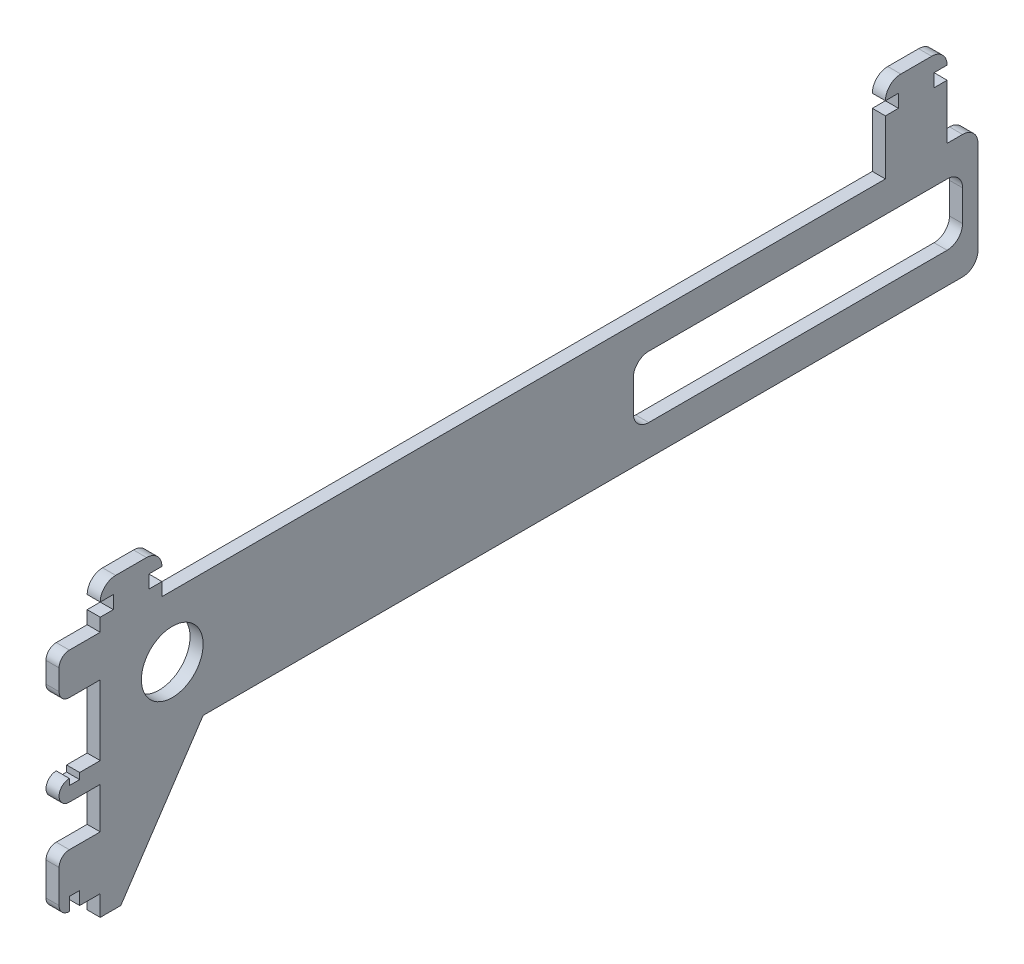
from build123d import *

# Parameters (mm, degrees)
SKETCH1_R           = 7.5
BOSS_EXTRUDE1_DEPTH = 3.175


with BuildPart() as part:
    # Sketch1 → Boss-Extrude1 (new body)
    with BuildSketch(Plane(origin=(0, 0, 0), x_dir=(0, 0, -1), z_dir=(1, 0, 0))):
        with BuildLine():
            Line((-94.755, 15), (-94.755, 18.175))
            Line((-94.755, 18.175), (-97.93, 18.175))
            Line((-97.93, 18.175), (-97.93, 21.35))
            Line((-97.93, 21.35), (-94.755, 21.35))
            ThreePointArc((-94.755, 21.35), (-95.853349571, 24.001650429), (-98.505, 25.1))
            Line((-98.505, 25.1), (-106.005, 25.1))
            ThreePointArc((-106.005, 25.1), (-108.656650429, 24.001650429), (-109.755, 21.35))
            Line((-109.755, 21.35), (-106.58, 21.35))
            Line((-106.58, 21.35), (-106.58, 18.175))
            Line((-106.58, 18.175), (-109.755, 18.175))
            Line((-109.755, 18.175), (-109.755, 15))
            Line((-109.755, 15), (-117.255, 15))
            ThreePointArc((-117.255, 15), (-119.022766953, 14.267766953), (-119.755, 12.5))
            Line((-119.755, 12.5), (-119.755, 7.5))
            ThreePointArc((-119.755, 7.5), (-119.022766953, 5.732233047), (-117.255, 5))
            Line((-117.255, 5), (-109.755, 5))
            Line((-109.755, 5), (-109.755, -12))
            Line((-109.755, -12), (-114.755, -12))
            Line((-114.755, -12), (-114.755, -13.5))
            Line((-114.755, -13.5), (-117.255, -13.5))
            Line((-117.255, -13.5), (-117.255, -12))
            ThreePointArc((-117.255, -12), (-119.755, -14.5), (-117.255, -17))
            Line((-117.255, -17), (-109.755, -17))
            Line((-109.755, -17), (-109.755, -27))
            Line((-109.755, -27), (-117.255, -27))
            ThreePointArc((-117.255, -27), (-119.022766953, -27.732233047), (-119.755, -29.5))
            Line((-119.755, -29.5), (-119.755, -37.5))
            ThreePointArc((-119.755, -37.5), (-119.022766953, -39.267766953), (-117.255, -40))
            Line((-117.255, -40), (-117.255, -36.825))
            Line((-117.255, -36.825), (-114.755, -36.825))
            Line((-114.755, -36.825), (-114.755, -40))
            Line((-114.755, -40), (-109.755, -40))
            Line((-109.755, -40), (-109.755, -45))
            Line((-109.755, -45), (-104.755, -45))
            Line((-104.755, -45), (-84.755, -15))
            Line((-84.755, -15), (99.755, -15))
            ThreePointArc((99.755, -15), (102.406650429, -13.901650429), (103.505, -11.25))
            Line((103.505, -11.25), (103.505, 11.25))
            ThreePointArc((103.505, 11.25), (102.406650429, 13.901650429), (99.755, 15))
            Line((99.755, 15), (96.005, 15))
            Line((96.005, 15), (96.005, 28.275))
            Line((96.005, 28.275), (92.83, 28.275))
            Line((92.83, 28.275), (92.83, 31.45))
            Line((92.83, 31.45), (96.005, 31.45))
            ThreePointArc((96.005, 31.45), (94.906650429, 34.101650429), (92.255, 35.2))
            Line((92.255, 35.2), (84.755, 35.2))
            ThreePointArc((84.755, 35.2), (82.103349571, 34.101650429), (81.005, 31.45))
            Line((81.005, 31.45), (84.18, 31.45))
            Line((84.18, 31.45), (84.18, 28.275))
            Line((84.18, 28.275), (81.005, 28.275))
            Line((81.005, 28.275), (81.005, 15))
            Line((81.005, 15), (-94.755, 15))
        make_face()
        with Locations((-92.255, 0)):
            Circle(SKETCH1_R, mode=Mode.SUBTRACT)
        with BuildLine():
            Line((23.505, 7.5), (96.005, 7.5))
            ThreePointArc((96.005, 7.5), (98.656650429, 6.401650429), (99.755, 3.75))
            Line((99.755, 3.75), (99.755, -3.75))
            ThreePointArc((99.755, -3.75), (98.656650429, -6.401650429), (96.005, -7.5))
            Line((96.005, -7.5), (23.505, -7.5))
            ThreePointArc((23.505, -7.5), (20.853349571, -6.401650429), (19.755, -3.75))
            Line((19.755, -3.75), (19.755, 3.75))
            ThreePointArc((19.755, 3.75), (20.853349571, 6.401650429), (23.505, 7.5))
        make_face(mode=Mode.SUBTRACT)
    extrude(amount=BOSS_EXTRUDE1_DEPTH)


solid = part.part
